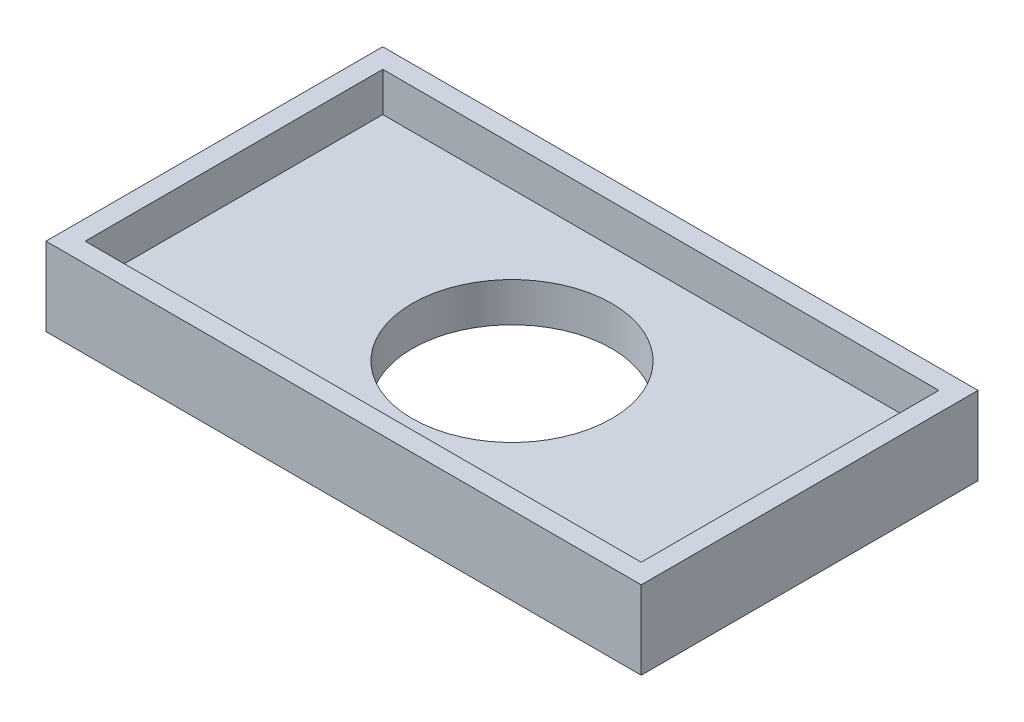
from build123d import *

# Parameters (mm, degrees)
SKETCH1_W                          = 152
SKETCH1_H                          = 86
BOSS_EXTRUDE1_DEPTH                = 10
SKETCH2_W                          = 152
SKETCH2_H                          = 86
SKETCH2_W_2                        = 142
SKETCH2_H_2                        = 76
BOSS_EXTRUDE2_DEPTH                = 10
F_2_0350_40_UNS_TAPPED_HOLE1_D     = 50.955575
F_2_0350_40_UNS_TAPPED_HOLE1_DEPTH = 106.56


with BuildPart() as part:
    # Sketch1 → Boss-Extrude1 (new body)
    with BuildSketch(Plane(origin=(0, 0, 0), x_dir=(1, 0, 0), z_dir=(0, 1, 0))):
        Rectangle(SKETCH1_W, SKETCH1_H)
    extrude(amount=BOSS_EXTRUDE1_DEPTH)

    # Sketch2 → Boss-Extrude2 (add)
    with BuildSketch(Plane(origin=(0, 10, 0), x_dir=(1, 0, 0), z_dir=(0, 1, 0))):
        Rectangle(SKETCH2_W, SKETCH2_H)
        Rectangle(SKETCH2_W_2, SKETCH2_H_2, mode=Mode.SUBTRACT)
    extrude(amount=BOSS_EXTRUDE2_DEPTH)

    # 2.0350-40 UNS Tapped Hole1
    with Locations(Plane(origin=(0, 0, 0), x_dir=(-1, 0, 0), z_dir=(0, -1, 0))):
        with Locations((0, 0)):
            Hole(F_2_0350_40_UNS_TAPPED_HOLE1_D / 2, depth=F_2_0350_40_UNS_TAPPED_HOLE1_DEPTH)


solid = part.part
